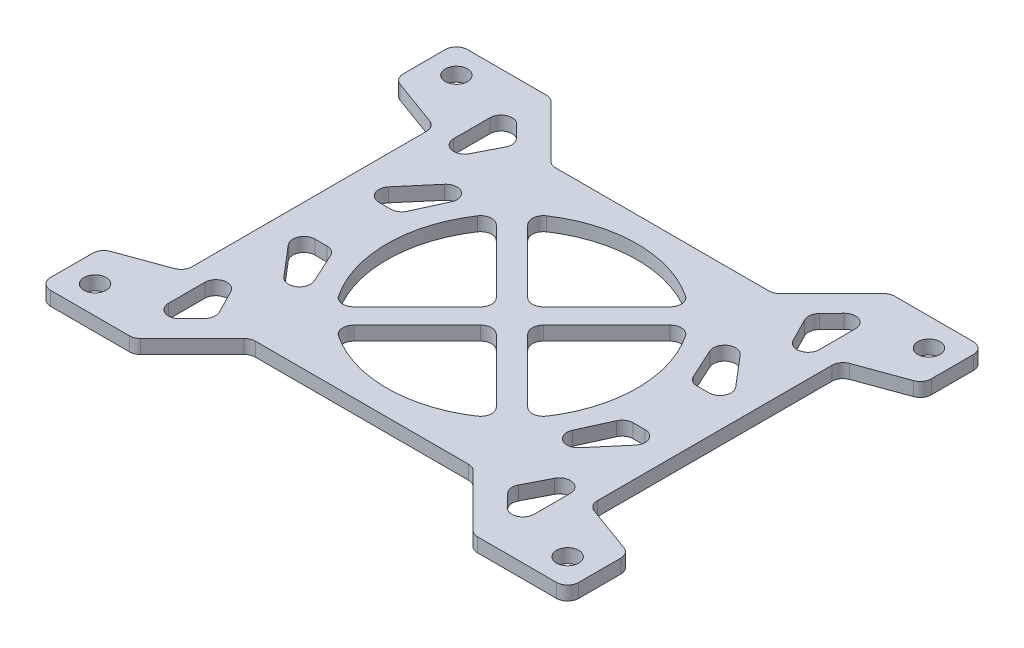
from build123d import *

# Parameters (mm, degrees)
EXTRUDE_1_DEPTH     = 2.5
SKETCH_3_R          = 2
CUT_EXTRUDE_1_DEPTH = 61.570207198
CUT_EXTRUDE_2_DEPTH = 61.570207198
FILLET_1_R          = 2
FILLET_2_R          = 2


with BuildPart() as part:
    # 草图2 → 凸台-拉伸1 (new body)
    with BuildSketch(Plane(origin=(0, 0, 0), x_dir=(1, 0, 0), z_dir=(0, 1, 0))):
        Polygon((-47.5, 37.5), (-30.5, 37.5), (-20, 27), (20, 27), (30.5, 37.5), (47.5, 37.5), (47.5, 26.521871089), (36.45, 22.5), (36.45, -22.5), (47.5, -26.521871089), (47.5, -37.5), (30.5, -37.5), (20, -27), (-20, -27), (-30.5, -37.5), (-47.5, -37.5), (-47.5, -26.521871089), (-36.45, -22.5), (-36.45, 22.5), (-47.5, 26.521871089), align=None)
    extrude(amount=EXTRUDE_1_DEPTH)

    # 草图3 → 切除-拉伸1 (cut, through all)
    with BuildSketch(Plane(origin=(0, 2.5, 0), x_dir=(1, 0, 0), z_dir=(0, 1, 0))):
        with Locations(Location((-42.5, -32.5, 0), (0, 0, 270))):
            Circle(SKETCH_3_R)
        with Locations(Location((42.5, -32.5, 0), (0, 0, 270))):
            Circle(SKETCH_3_R)
        with Locations(Location((42.5, 32.5, 0), (0, 0, 90))):
            Circle(SKETCH_3_R)
        with Locations(Location((-42.5, 32.5, 0), (0, 0, 90))):
            Circle(SKETCH_3_R)
    extrude(amount=-CUT_EXTRUDE_1_DEPTH, mode=Mode.SUBTRACT)

    # 草图4 → 切除-拉伸2 (cut, through all)
    with BuildSketch(Plane(origin=(0, 2.5, 0), x_dir=(1, 0, 0), z_dir=(0, 1, 0))):
        with BuildLine():
            Line((14.432710429, 17.261137554), (0, 2.828427125))
            Line((0, 2.828427125), (-14.432710429, 17.261137554))
            ThreePointArc((-14.432710429, 17.261137554), (0, 22.5), (14.432710429, 17.261137554))
        make_face()
        with BuildLine():
            Line((17.261137554, 14.432710429), (2.828427125, 0))
            Line((2.828427125, 0), (17.261137554, -14.432710429))
            ThreePointArc((17.261137554, -14.432710429), (22.5, 0), (17.261137554, 14.432710429))
        make_face()
        with BuildLine():
            Line((14.432710429, -17.261137554), (0, -2.828427125))
            Line((0, -2.828427125), (-14.432710429, -17.261137554))
            ThreePointArc((-14.432710429, -17.261137554), (0, -22.5), (14.432710429, -17.261137554))
        make_face()
        with BuildLine():
            Line((-17.261137554, 14.432710429), (-2.828427125, 0))
            Line((-2.828427125, 0), (-17.261137554, -14.432710429))
            ThreePointArc((-17.261137554, -14.432710429), (-22.5, 0), (-17.261137554, 14.432710429))
        make_face()
        Polygon((-17.261137554, 25.402553145), (-34.014066988, 5.737935313), (-26.260100349, 5.737935313), align=None)
        Polygon((-32.876818547, 14.112219282), (-26.260100349, 27), (-32.876818547, 33.858987655), align=None)
        Polygon((26.260100349, 27), (32.876818547, 33.858987655), (32.876818547, 14.112219282), align=None)
        Polygon((34.014066988, 5.737935313), (26.260100349, 5.737935313), (17.261137554, 25.402553145), align=None)
        Polygon((32.876818547, -14.112219282), (26.260100349, -27), (32.876818547, -33.858987655), align=None)
        Polygon((17.261137554, -25.402553145), (34.014066988, -5.737935313), (26.260100349, -5.737935313), align=None)
        Polygon((-26.260100349, -27), (-32.876818547, -33.858987655), (-32.876818547, -14.112219282), align=None)
        Polygon((-34.014066988, -5.737935313), (-26.260100349, -5.737935313), (-17.261137554, -25.402553145), align=None)
    extrude(amount=-CUT_EXTRUDE_2_DEPTH, mode=Mode.SUBTRACT)

    # 圆角1
    fillet_1_edges = [part.edges().sort_by_distance(p)[0] for p in [
        (-32.876818547, 1.25, -14.112219282),
        (-32.876818547, 1.25, -33.858987655),
        (-26.260100349, 1.25, -27),
        (32.876818547, 1.25, -14.112219282),
        (26.260100349, 1.25, -27),
        (32.876818547, 1.25, -33.858987655),
        (17.261137554, 1.25, -25.402553145),
        (34.014066988, 1.25, -5.737935313),
        (26.260100349, 1.25, -5.737935313),
        (32.876818547, 1.25, 14.112219282),
        (32.876818547, 1.25, 33.858987655),
        (26.260100349, 1.25, 27),
        (14.432710429, 1.25, 17.261137554),
        (-14.432710429, 1.25, 17.261137554),
        (0, 1.25, 2.828427125),
        (17.261137554, 1.25, -14.432710429),
        (17.261137554, 1.25, 14.432710429),
        (2.828427125, 1.25, 0),
        (-17.261137554, 1.25, -25.402553145),
        (-26.260100349, 1.25, -5.737935313),
        (-34.014066988, 1.25, -5.737935313),
        (-17.261137554, 1.25, 14.432710429),
        (-17.261137554, 1.25, -14.432710429),
        (-2.828427125, 1.25, 0),
        (-17.261137554, 1.25, 25.402553145),
        (-34.014066988, 1.25, 5.737935313),
        (-26.260100349, 1.25, 5.737935313),
        (-32.876818547, 1.25, 14.112219282),
        (-26.260100349, 1.25, 27),
        (-32.876818547, 1.25, 33.858987655),
        (17.261137554, 1.25, 25.402553145),
        (26.260100349, 1.25, 5.737935313),
        (34.014066988, 1.25, 5.737935313),
        (-14.432710429, 1.25, -17.261137554),
        (14.432710429, 1.25, -17.261137554),
        (0, 1.25, -2.828427125),
    ]]
    fillet(fillet_1_edges, radius=FILLET_1_R)

    # 圆角2
    fillet_2_edges = [part.edges().sort_by_distance(p)[0] for p in [
        (30.5, 1.25, 37.5),
        (20, 1.25, 27),
        (-20, 1.25, 27),
        (-30.5, 1.25, 37.5),
        (-47.5, 1.25, 37.5),
        (-47.5, 1.25, 26.521871089),
        (-36.45, 1.25, 22.5),
        (-36.45, 1.25, -22.5),
        (-47.5, 1.25, -26.521871089),
        (-47.5, 1.25, -37.5),
        (-30.5, 1.25, -37.5),
        (-20, 1.25, -27),
        (20, 1.25, -27),
        (30.5, 1.25, -37.5),
        (47.5, 1.25, -37.5),
        (47.5, 1.25, -26.521871089),
        (36.45, 1.25, -22.5),
        (36.45, 1.25, 22.5),
        (47.5, 1.25, 26.521871089),
        (47.5, 1.25, 37.5),
    ]]
    fillet(fillet_2_edges, radius=FILLET_2_R)


solid = part.part
